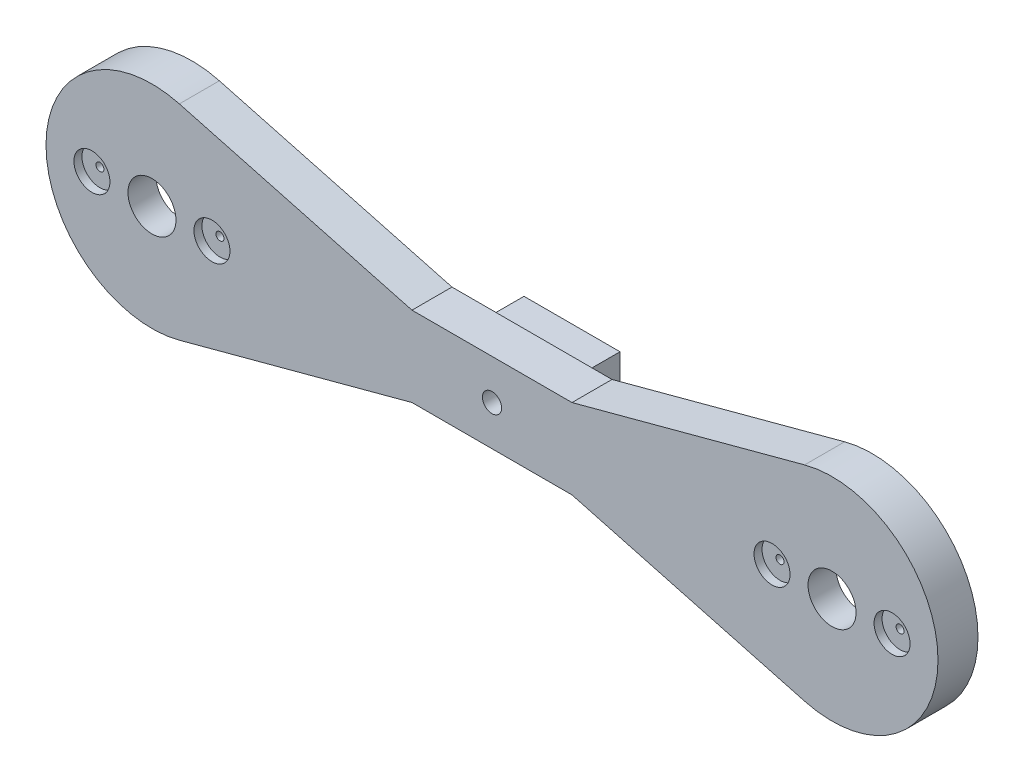
from build123d import *

# Parameters (mm, degrees)
SKETCH_1_R          = 3
EXTRUDE_1_DEPTH     = 5
SKETCH_3_W          = 12
SKETCH_3_H          = 7
SKETCH_3_W_2        = 10
SKETCH_3_H_2        = 5
EXTRUDE_1_2_DEPTH   = 5
CUT_EXTRUDE_2_REACH = 59.51
SKETCH_4_R          = 1.2
SKETCH_5_R          = 9
CUT_EXTRUDE_3_DEPTH = 1.5
SKETCH_6_R          = 0.5
CUT_EXTRUDE_4_DEPTH = 5
SKETCH_7_R          = 2.25
CUT_EXTRUDE_5_DEPTH = 1


with BuildPart() as part:
    # 草图1 → Extrude 1 (new body)
    with BuildSketch(Plane.XY):
        with BuildLine():
            Line((-10, 5), (10, 5))
            Line((10, 5), (39.072912811, 12.790063509))
            ThreePointArc((39.072912811, 12.790063509), (55.741248097, 0), (39.072912811, -12.790063509))
            Line((39.072912811, -12.790063509), (10, -5))
            Line((10, -5), (-10, -5))
            Line((-10, -5), (-39.072912811, -12.790063509))
            ThreePointArc((-39.072912811, -12.790063509), (-55.741248097, 0), (-39.072912811, 12.790063509))
            Line((-39.072912811, 12.790063509), (-10, 5))
        make_face()
        with Locations((-42.5, 0)):
            Circle(SKETCH_1_R, mode=Mode.SUBTRACT)
        with Locations((42.5, 0)):
            Circle(SKETCH_1_R, mode=Mode.SUBTRACT)
    extrude(amount=EXTRUDE_1_DEPTH)

    # 草图3 → Extrude 1 2 (add)
    with BuildSketch(Plane(origin=(0, 0, 0), x_dir=(-1, 0, 0), z_dir=(0, 0, -1))):
        Rectangle(SKETCH_3_W, SKETCH_3_H)
        Rectangle(SKETCH_3_W_2, SKETCH_3_H_2, mode=Mode.SUBTRACT)
    extrude(amount=EXTRUDE_1_2_DEPTH)

    # 草图4 → 切除-拉伸2 (cut, up to next)
    with BuildSketch(Plane(origin=(0, 0, 0), x_dir=(-1, 0, 0), z_dir=(0, 0, -1)), mode=Mode.PRIVATE) as cut_extrude_2_sk1:
        Circle(SKETCH_4_R)
    cut_extrude_2_tool1 = extrude(cut_extrude_2_sk1.sketch, amount=-CUT_EXTRUDE_2_REACH, mode=Mode.PRIVATE) & part.part
    add(cut_extrude_2_tool1.solids().sort_by_distance((0, 0, 0))[0], mode=Mode.SUBTRACT)

    # 草图5 → 切除-拉伸3 (cut)
    with BuildSketch(Plane(origin=(0, 0, 0), x_dir=(-1, 0, 0), z_dir=(0, 0, -1))):
        with Locations((-42.5, 0)):
            Circle(SKETCH_5_R)
        with Locations((42.5, 0)):
            Circle(SKETCH_5_R)
    extrude(amount=-CUT_EXTRUDE_3_DEPTH, mode=Mode.SUBTRACT)

    # 草图6 → 切除-拉伸4 (cut)
    with BuildSketch(Plane(origin=(0, 0, 1.5), x_dir=(-1, 0, 0), z_dir=(0, 0, -1))):
        with Locations((-50, 0)):
            Circle(SKETCH_6_R)
        with Locations((-35, 0)):
            Circle(SKETCH_6_R)
        with Locations(Location((35, 0, 0), (0, 0, 180))):
            Circle(SKETCH_6_R)
        with Locations(Location((50, 0, 0), (0, 0, 180))):
            Circle(SKETCH_6_R)
    extrude(amount=-CUT_EXTRUDE_4_DEPTH, mode=Mode.SUBTRACT)

    # 草图7 → 切除-拉伸5 (cut)
    with BuildSketch(Plane.XY.offset(5)):
        with Locations((-50, 0)):
            Circle(SKETCH_7_R)
        with Locations((-35, 0)):
            Circle(SKETCH_7_R)
        with Locations((35, 0)):
            Circle(SKETCH_7_R)
        with Locations((50, 0)):
            Circle(SKETCH_7_R)
    extrude(amount=-CUT_EXTRUDE_5_DEPTH, mode=Mode.SUBTRACT)


solid = part.part
